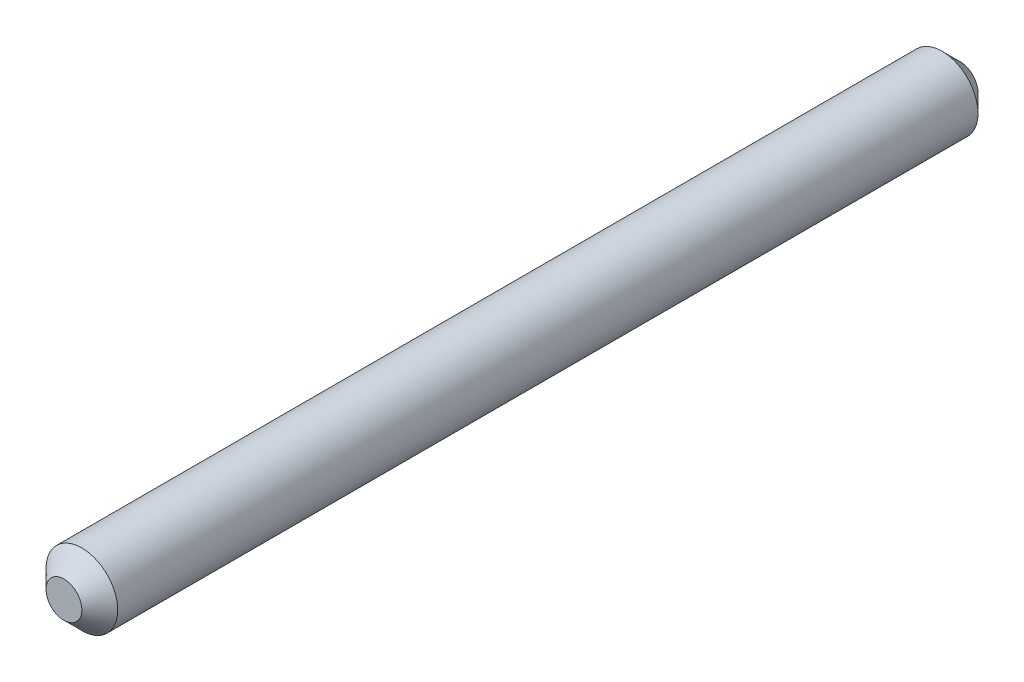
from build123d import *

# Parameters (mm, degrees)
SKETCH1_R           = 1
BOSS_EXTRUDE1_DEPTH = 25
CHAMFER1_SIZE       = 0.5


with BuildPart() as part:
    # Sketch1 → Boss-Extrude1 (new body)
    with BuildSketch(Plane.XY):
        Circle(SKETCH1_R)
    extrude(amount=BOSS_EXTRUDE1_DEPTH)

    # Chamfer1
    chamfer1_edges = [part.edges().sort_by_distance(p)[0] for p in [
        (-1, 0, 0),
        (-1, 0, 25),
    ]]
    chamfer(chamfer1_edges, length=CHAMFER1_SIZE)


solid = part.part
